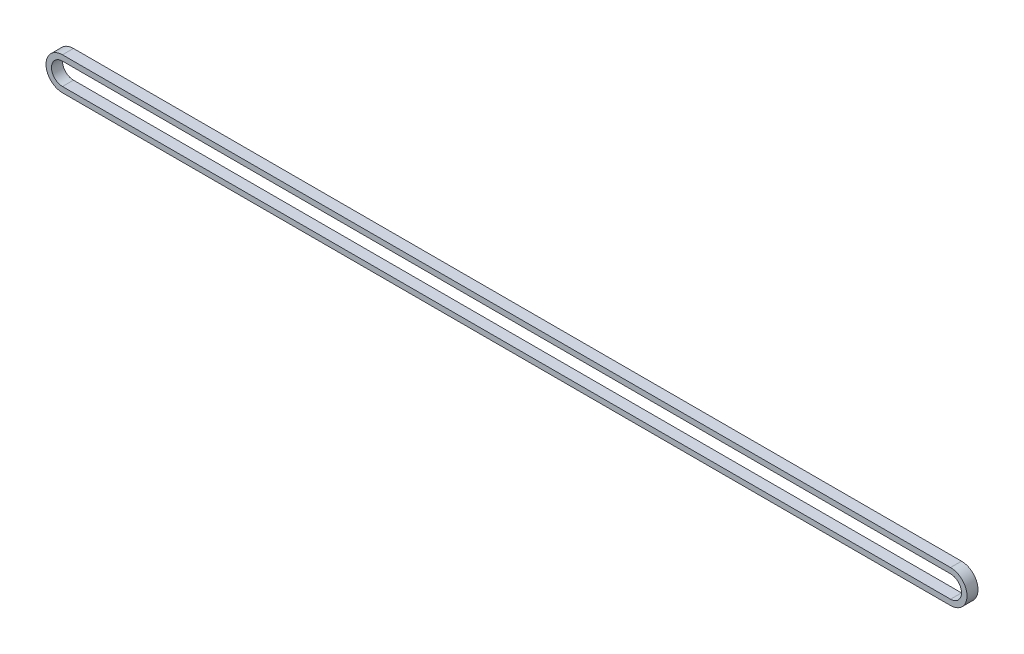
from build123d import *

# Parameters (mm, degrees)
BOSS_EXTRUDE1_DEPTH = 6


with BuildPart() as part:
    # Sketch1 → Boss-Extrude1 (new body)
    with BuildSketch(Plane.XY):
        with BuildLine():
            Line((-242.5, 9), (242.5, 9))
            ThreePointArc((242.5, 9), (251.5, 0), (242.5, -9))
            Line((242.5, -9), (-242.5, -9))
            ThreePointArc((-242.5, -9), (-251.5, 0), (-242.5, 9))
        make_face()
        with BuildLine():
            Line((-242.5, -6), (242.5, -6))
            ThreePointArc((242.5, -6), (248.5, 0), (242.5, 6))
            Line((242.5, 6), (-242.5, 6))
            ThreePointArc((-242.5, 6), (-248.5, 0), (-242.5, -6))
        make_face(mode=Mode.SUBTRACT)
    extrude(amount=BOSS_EXTRUDE1_DEPTH)


solid = part.part
